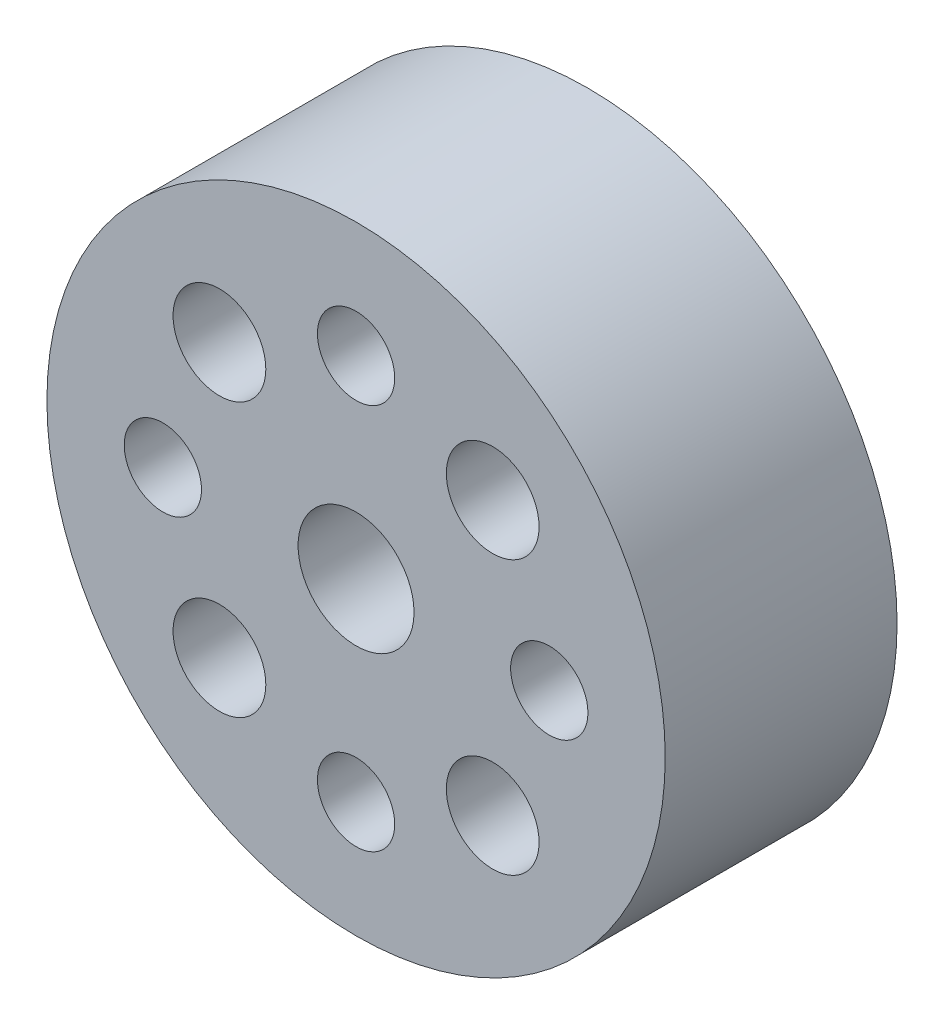
from build123d import *

# Parameters (mm, degrees)
SKIZZE1_R                       = 40
AUFSATZ_LINEAR_AUSTRAGEN1_DEPTH = 30
SKIZZE2_R                       = 5
SCHNITT_LINEAR_AUSTRAGEN1_DEPTH = 25
SKIZZE4_R                       = 6
SCHNITT_LINEAR_AUSTRAGEN5_DEPTH = 25
SKIZZE5_R                       = 7.5
SCHNITT_LINEAR_AUSTRAGEN6_DEPTH = 25


with BuildPart() as part:
    # Skizze1 → Aufsatz-Linear austragen1 (new body)
    with BuildSketch(Plane.XY):
        Circle(SKIZZE1_R)
    extrude(amount=AUFSATZ_LINEAR_AUSTRAGEN1_DEPTH)

    # Skizze2 → Schnitt-Linear austragen1 (cut)
    with BuildSketch(Plane.XY.offset(30)):
        with Locations((25, 0)):
            Circle(SKIZZE2_R)
        with Locations((0, -25)):
            Circle(SKIZZE2_R)
        with Locations((-25, 0)):
            Circle(SKIZZE2_R)
        with Locations((0, 25)):
            Circle(SKIZZE2_R)
    extrude(amount=-SCHNITT_LINEAR_AUSTRAGEN1_DEPTH, mode=Mode.SUBTRACT)

    # Skizze4 → Schnitt-Linear austragen5 (cut)
    with BuildSketch(Plane.XY.offset(30)):
        with Locations((17.67766953, 17.67766953)):
            Circle(SKIZZE4_R)
        with Locations((17.67766953, -17.67766953)):
            Circle(SKIZZE4_R)
        with Locations((-17.67766953, -17.67766953)):
            Circle(SKIZZE4_R)
        with Locations((-17.67766953, 17.67766953)):
            Circle(SKIZZE4_R)
    extrude(amount=-SCHNITT_LINEAR_AUSTRAGEN5_DEPTH, mode=Mode.SUBTRACT)

    # Skizze5 → Schnitt-Linear austragen6 (cut)
    with BuildSketch(Plane.XY.offset(30)):
        Circle(SKIZZE5_R)
    extrude(amount=-SCHNITT_LINEAR_AUSTRAGEN6_DEPTH, mode=Mode.SUBTRACT)


solid = part.part
